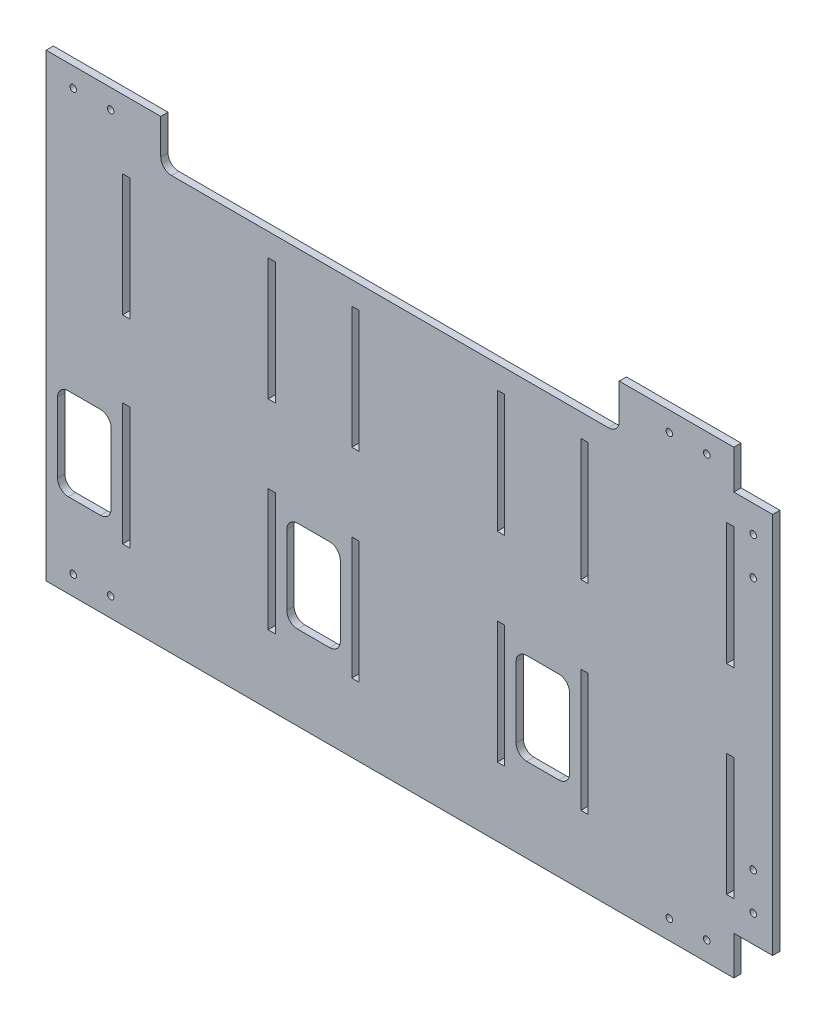
from build123d import *

# Parameters (mm, degrees)
SKETCH_1_W          = 500.8
SKETCH_1_H          = 300.8
EXTRUDE_1_DEPTH     = 4.75
SKETCH_2_W          = 25.4
SKETCH_2_H          = 25.4
SKETCH_2_H_2        = 300.8
SKETCH_2_W_2        = 4.75
SKETCH_2_H_3        = 80
CUT_EXTRUDE_1_DEPTH = 10
SKETCH_3_R          = 2.15
SKETCH_3_R_2        = 2.150000004
CUT_EXTRUDE_2_DEPTH = 5
SKETCH_5_W          = 35
SKETCH_5_H          = 60
SKETCH_5_W_2        = 300
SKETCH_5_H_2        = 30
CUT_EXTRUDE_3_DEPTH = 10
FILLET_1_R          = 7


with BuildPart() as part:
    # 草圖1 → 填料-伸長1 (new body)
    with BuildSketch(Plane.XY):
        Rectangle(SKETCH_1_W, SKETCH_1_H)
    extrude(amount=EXTRUDE_1_DEPTH)

    # 草圖2 → 除料-伸長1 (cut)
    with BuildSketch(Plane(origin=(0, 0, 0), x_dir=(-1, 0, 0), z_dir=(0, 0, -1))):
        with Locations((-237.7, 137.7)):
            Rectangle(SKETCH_2_W, SKETCH_2_H)
        with Locations((-237.7, -137.7)):
            Rectangle(SKETCH_2_W, SKETCH_2_H)
        with Locations((237.7, 0)):
            Rectangle(SKETCH_2_W, SKETCH_2_H_2)
        with Locations((-222.625, 65.4)):
            Rectangle(SKETCH_2_W_2, SKETCH_2_H_3)
        with Locations((-222.625, -65.4)):
            Rectangle(SKETCH_2_W_2, SKETCH_2_H_3)
        with Locations((172.625, 65.4)):
            Rectangle(SKETCH_2_W_2, SKETCH_2_H_3)
        with Locations((172.625, -64.4)):
            Rectangle(SKETCH_2_W_2, SKETCH_2_H_3)
        with Locations((-127.375, 65.4)):
            Rectangle(SKETCH_2_W_2, SKETCH_2_H_3)
        with Locations((-72.625, 65.4)):
            Rectangle(SKETCH_2_W_2, SKETCH_2_H_3)
        with Locations((22.625, 65.4)):
            Rectangle(SKETCH_2_W_2, SKETCH_2_H_3)
        with Locations((77.375, 65.4)):
            Rectangle(SKETCH_2_W_2, SKETCH_2_H_3)
        with Locations((77.375, -65.4)):
            Rectangle(SKETCH_2_W_2, SKETCH_2_H_3)
        with Locations((22.625, -65.4)):
            Rectangle(SKETCH_2_W_2, SKETCH_2_H_3)
        with Locations((-127.375, -65.4)):
            Rectangle(SKETCH_2_W_2, SKETCH_2_H_3)
        with Locations((-72.625, -65.4)):
            Rectangle(SKETCH_2_W_2, SKETCH_2_H_3)
    extrude(amount=-CUT_EXTRUDE_1_DEPTH, mode=Mode.SUBTRACT)

    # 草圖3 → 除料-伸長2 (cut)
    with BuildSketch(Plane.XY.offset(4.75)):
        with Locations((-207.3, 137.7)):
            Circle(SKETCH_3_R)
        with Locations((-182.8, 137.7)):
            Circle(SKETCH_3_R)
        with Locations((182.8, 137.7)):
            Circle(SKETCH_3_R)
        with Locations((207.3, 137.7)):
            Circle(SKETCH_3_R)
        with Locations((237.7, 107.3)):
            Circle(SKETCH_3_R)
        with Locations((237.7, 82.8)):
            Circle(SKETCH_3_R)
        with Locations((237.7, -82.800000014)):
            Circle(SKETCH_3_R_2)
        with Locations((237.7, -107.300000014)):
            Circle(SKETCH_3_R_2)
        with Locations((207.3, -137.7)):
            Circle(SKETCH_3_R)
        with Locations((182.8, -137.7)):
            Circle(SKETCH_3_R)
        with Locations((-207.3, -137.7)):
            Circle(SKETCH_3_R)
        with Locations((-182.8, -137.7)):
            Circle(SKETCH_3_R)
    extrude(amount=-CUT_EXTRUDE_2_DEPTH, mode=Mode.SUBTRACT)

    # 草圖5 → 除料-伸長3 (cut)
    with BuildSketch(Plane.XY.offset(4.75)):
        with Locations((100, -65.4)):
            Rectangle(SKETCH_5_W, SKETCH_5_H)
        with Locations((-50, -65.4)):
            Rectangle(SKETCH_5_W, SKETCH_5_H)
        with Locations((-200, -65.4)):
            Rectangle(SKETCH_5_W, SKETCH_5_H)
        with Locations((0, 135.4)):
            Rectangle(SKETCH_5_W_2, SKETCH_5_H_2)
    extrude(amount=-CUT_EXTRUDE_3_DEPTH, mode=Mode.SUBTRACT)

    # 圓角1
    fillet_1_edges = [part.edges().sort_by_distance(p)[0] for p in [
        (-150, 120.4, 2.375),
        (150, 120.4, 2.375),
        (-182.5, -35.4, 2.375),
        (-182.5, -95.4, 2.375),
        (-217.5, -95.4, 2.375),
        (-217.5, -35.4, 2.375),
        (-32.5, -35.4, 2.375),
        (-32.5, -95.4, 2.375),
        (-67.5, -95.4, 2.375),
        (-67.5, -35.4, 2.375),
        (117.5, -35.4, 2.375),
        (117.5, -95.4, 2.375),
        (82.5, -95.4, 2.375),
        (82.5, -35.4, 2.375),
    ]]
    fillet(fillet_1_edges, radius=FILLET_1_R)


solid = part.part
